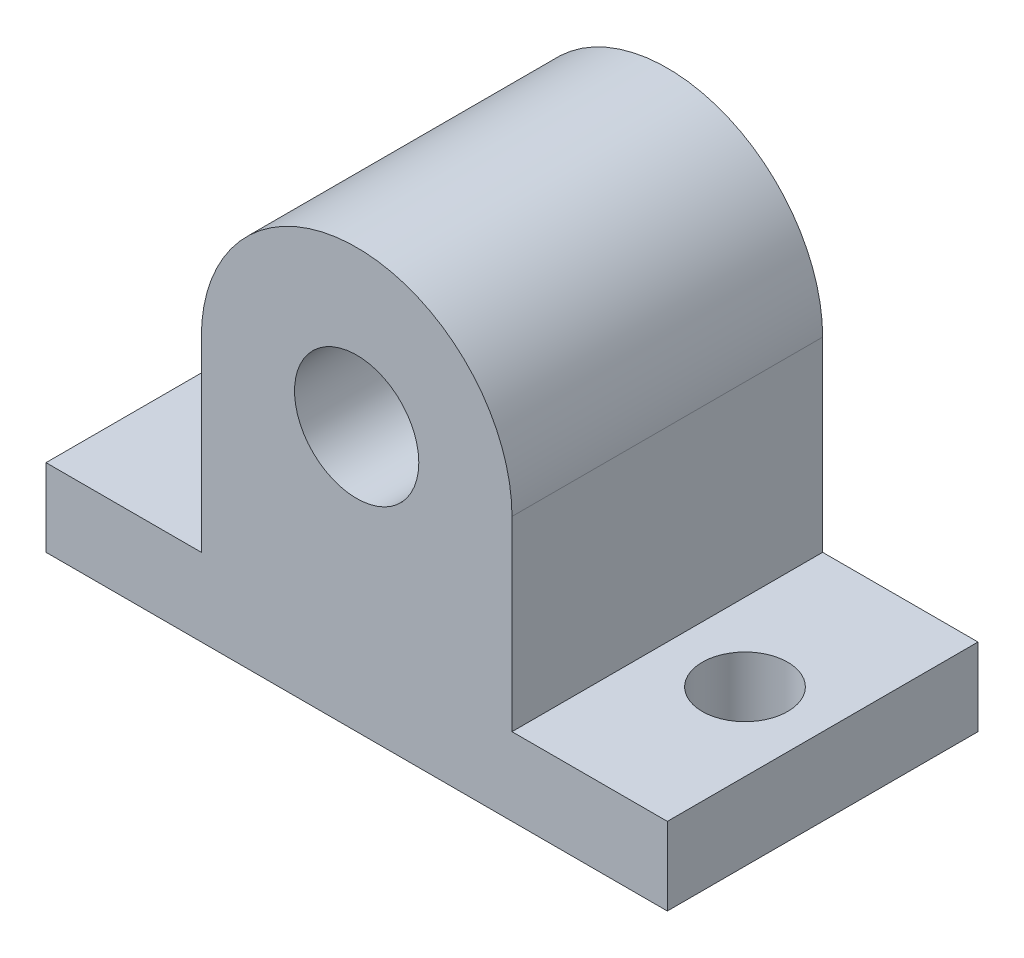
from build123d import *

# Parameters (mm, degrees)
SKETCH_1_W          = 40
SKETCH_1_H          = 20
EXTRUDE_1_DEPTH     = 5
SKETCH_2_R          = 4
EXTRUDE_2_DEPTH     = 20
SKETCH_3_R          = 2.75
CUT_EXTRUDE_1_DEPTH = 36.595319622


with BuildPart() as part:
    # 草图1 → 凸台-拉伸1 (new body)
    with BuildSketch(Plane(origin=(0, 0, 0), x_dir=(1, 0, 0), z_dir=(0, 1, 0))):
        with Locations((3.522012579, -5.157232704)):
            Rectangle(SKETCH_1_W, SKETCH_1_H)
    extrude(amount=EXTRUDE_1_DEPTH)

    # 草图2 → 凸台-拉伸2 (add)
    with BuildSketch(Plane.XY.offset(15.157232704)):
        with BuildLine():
            Line((-6.477987421, 17), (-6.477987421, 5))
            Line((-6.477987421, 5), (13.522012579, 5))
            Line((13.522012579, 5), (13.522012579, 17))
            ThreePointArc((13.522012579, 17), (3.522012579, 27), (-6.477987421, 17))
        make_face()
        with Locations((3.522012579, 17)):
            Circle(SKETCH_2_R, mode=Mode.SUBTRACT)
    extrude(amount=-EXTRUDE_2_DEPTH)

    # 草图3 → 切除-拉伸1 (cut, through all)
    with BuildSketch(Plane(origin=(0, 5, 0), x_dir=(1, 0, 0), z_dir=(0, 1, 0))):
        with Locations(Location((-11.477987421, -5.157232704, 0), (0, 0, 270))):
            Circle(SKETCH_3_R)
        with Locations(Location((18.522012579, -5.157232704, 0), (0, 0, 270))):
            Circle(SKETCH_3_R)
    extrude(amount=-CUT_EXTRUDE_1_DEPTH, mode=Mode.SUBTRACT)


solid = part.part
